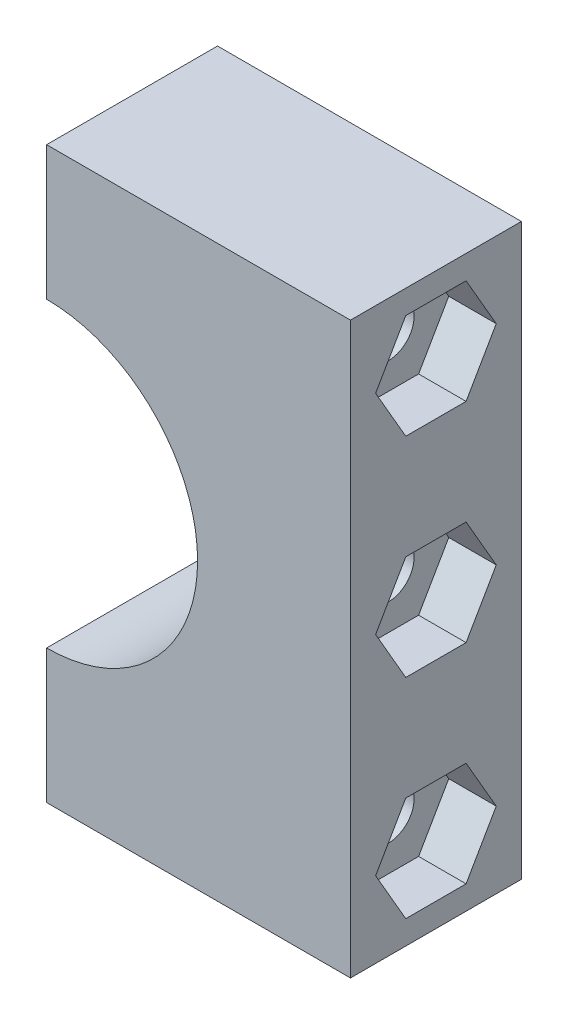
from build123d import *

# Parameters (mm, degrees)
IZIM1_R                     = 7.95
Y_KSEKLIK_EKSTR_ZYON1_DEPTH = 8
IZIM2_R                     = 1.35
KES_EKSTR_ZYON1_DEPTH       = 50
IZIM3_R                     = 1.35
KES_EKSTR_ZYON2_DEPTH       = 29
KES_EKSTR_ZYON3_DEPTH       = 10
Y_KSEKLIK_EKSTR_ZYON2_REACH = 46.587
IZIM5_W                     = 5.529758539
IZIM5_H                     = 16.549351305
IZIM6_R                     = 1.35
KES_EKSTR_ZYON4_DEPTH       = 10
KES_EKSTR_ZYON5_DEPTH       = 2.5
Y_KSEKLIK_EKSTR_ZYON3_DEPTH = 0.5


with BuildPart() as part:
    # Çizim1 → Yükseklik-Ekstrüzyon1 (new body)
    with BuildSketch(Plane.XY):
        with BuildLine():
            Line((0, 0), (32, 0))
            Line((32, 0), (32, 8))
            Line((32, 8), (31.5, 8))
            ThreePointArc((31.5, 8), (28.671572875, 9.171572875), (27.5, 12))
            Line((27.5, 12), (27.5, 18))
            ThreePointArc((27.5, 18), (28.671572875, 20.828427125), (31.5, 22))
            Line((31.5, 22), (32, 22))
            Line((32, 22), (32, 30))
            Line((32, 30), (0, 30))
            Line((0, 30), (0, 22))
            Line((0, 22), (0.5, 22))
            ThreePointArc((0.5, 22), (3.328427125, 20.828427125), (4.5, 18))
            Line((4.5, 18), (4.5, 12))
            ThreePointArc((4.5, 12), (3.328427125, 9.171572875), (0.5, 8))
            Line((0.5, 8), (0, 8))
            Line((0, 8), (0, 0))
        make_face()
        with Locations((16, 15)):
            Circle(IZIM1_R, mode=Mode.SUBTRACT)
    extrude(amount=Y_KSEKLIK_EKSTR_ZYON1_DEPTH)

    # Çizim2 → Kes-Ekstrüzyon1 (cut)
    with BuildSketch(Plane(origin=(32, 0, 0), x_dir=(0, 0, -1), z_dir=(1, 0, 0))):
        with Locations((-4, 4)):
            Circle(IZIM2_R)
        with Locations((-4, 26)):
            Circle(IZIM2_R)
    extrude(amount=-KES_EKSTR_ZYON1_DEPTH, mode=Mode.SUBTRACT)

    # Çizim3 → Kes-Ekstrüzyon2 (cut)
    with BuildSketch(Plane.ZY.offset(-4.5)):
        with Locations(Location((4, 15, 0), (0, 0, 270))):
            Circle(IZIM3_R)
    extrude(amount=-KES_EKSTR_ZYON2_DEPTH, mode=Mode.SUBTRACT)

    # Çizim4 → Kes-Ekstrüzyon3 (cut)
    with BuildSketch(Plane(origin=(0, 0, 0), x_dir=(-1, 0, 0), z_dir=(0, 0, -1))):
        Polygon((-16, 30), (-16, 0), (9.241069926, -10.278514345), (11.843794838, 24.557008953), (11.843794838, 39.531622814), align=None)
    extrude(amount=-KES_EKSTR_ZYON3_DEPTH, mode=Mode.SUBTRACT)

    # Yükseklik-Ekstrüzyon2: up to this face of the body (flat: up to its plane)
    y_kseklik_ekstr_zyon2_end = Plane(part.part.faces().sort_by_distance((24.391799767, 15, 8))[0])
    # Çizim5 → Yükseklik-Ekstrüzyon2 (add, up to the picked face)
    with BuildSketch(Plane(origin=(0, 0, 0), x_dir=(-1, 0, 0), z_dir=(0, 0, -1)), mode=Mode.PRIVATE) as y_kseklik_ekstr_zyon2_sk1:
        with Locations((-29.235120731, 13.725324347)):
            Rectangle(IZIM5_W, IZIM5_H)
    y_kseklik_ekstr_zyon2_tool1 = split(extrude(y_kseklik_ekstr_zyon2_sk1.sketch, amount=-Y_KSEKLIK_EKSTR_ZYON2_REACH, mode=Mode.PRIVATE), bisect_by=y_kseklik_ekstr_zyon2_end, keep=Keep.BOTH, mode=Mode.PRIVATE)
    add(y_kseklik_ekstr_zyon2_tool1.solids().sort_by(Axis((29.235121, 13.725324, 0), (0, 0, 1)))[0])

    # Çizim6 → Kes-Ekstrüzyon4 (cut)
    with BuildSketch(Plane.ZY.offset(-26.470241461)):
        with Locations(Location((4, 15, 0), (0, 0, 270))):
            Circle(IZIM6_R)
    extrude(amount=-KES_EKSTR_ZYON4_DEPTH, mode=Mode.SUBTRACT)

    # Çizim7 → Kes-Ekstrüzyon5 (cut)
    with BuildSketch(Plane(origin=(32, 0, 0), x_dir=(0, 0, -1), z_dir=(1, 0, 0))):
        Polygon((-2.41228676, 28.75), (-5.58771324, 28.75), (-7.175426481, 26), (-5.58771324, 23.25), (-2.41228676, 23.25), (-0.824573519, 26), align=None)
        Polygon((-0.824573519, 15), (-2.41228676, 17.75), (-5.58771324, 17.75), (-7.175426481, 15), (-5.58771324, 12.25), (-2.41228676, 12.25), align=None)
        Polygon((-2.41228676, 6.75), (-5.58771324, 6.75), (-7.175426481, 4), (-5.58771324, 1.25), (-2.41228676, 1.25), (-0.824573519, 4), align=None)
    extrude(amount=-KES_EKSTR_ZYON5_DEPTH, mode=Mode.SUBTRACT)

    # Çizim8 → Yükseklik-Ekstrüzyon3 (add)
    with BuildSketch(Plane.XY.offset(8)):
        with BuildLine():
            Line((32, 30), (32, 0))
            Line((32, 0), (16, 0))
            Line((16, 0), (16, 7.05))
            ThreePointArc((16, 7.05), (23.95, 15), (16, 22.95))
            Line((16, 22.95), (16, 30))
            Line((16, 30), (32, 30))
        make_face()
    y_kseklik_ekstr_zyon3 = extrude(amount=Y_KSEKLIK_EKSTR_ZYON3_DEPTH)

    # Aynalama1: Yükseklik-Ekstrüzyon3 across plane
    add(y_kseklik_ekstr_zyon3.mirror(Plane.XY.offset(4)))


solid = part.part
